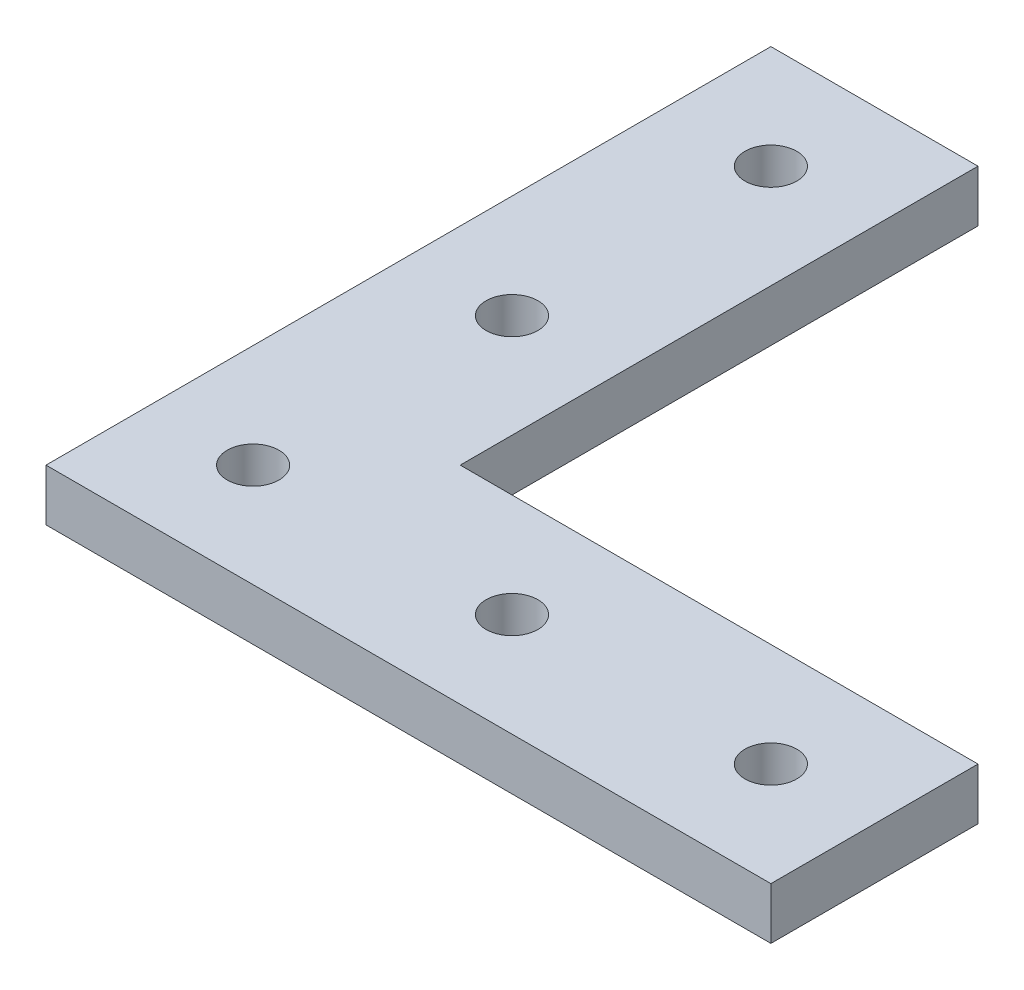
from build123d import *

# Parameters (mm, degrees)
EXTRUDE_1_DEPTH     = 5
SKETCH_2_R          = 2.5
CUT_EXTRUDE_1_DEPTH = 100.121138008


with BuildPart() as part:
    # 스케치1 → 보스-돌출1 (new body)
    with BuildSketch(Plane(origin=(0, 0, 0), x_dir=(1, 0, 0), z_dir=(0, 1, 0))):
        Polygon((0, 0), (0, 70), (20, 70), (20, 20), (70, 20), (70, 0), align=None)
    extrude(amount=EXTRUDE_1_DEPTH)

    # 스케치2 → 컷-돌출1 (cut, through all)
    with BuildSketch(Plane(origin=(0, 5, 0), x_dir=(1, 0, 0), z_dir=(0, 1, 0))):
        with Locations(Location((10, 60, 0), (0, 0, 270))):
            Circle(SKETCH_2_R)
        with Locations(Location((10, 35, 0), (0, 0, 270))):
            Circle(SKETCH_2_R)
        with Locations(Location((10, 10, 0), (0, 0, 270))):
            Circle(SKETCH_2_R)
        with Locations(Location((35, 10, 0), (0, 0, 270))):
            Circle(SKETCH_2_R)
        with Locations(Location((60, 10, 0), (0, 0, 270))):
            Circle(SKETCH_2_R)
    extrude(amount=-CUT_EXTRUDE_1_DEPTH, mode=Mode.SUBTRACT)


solid = part.part
